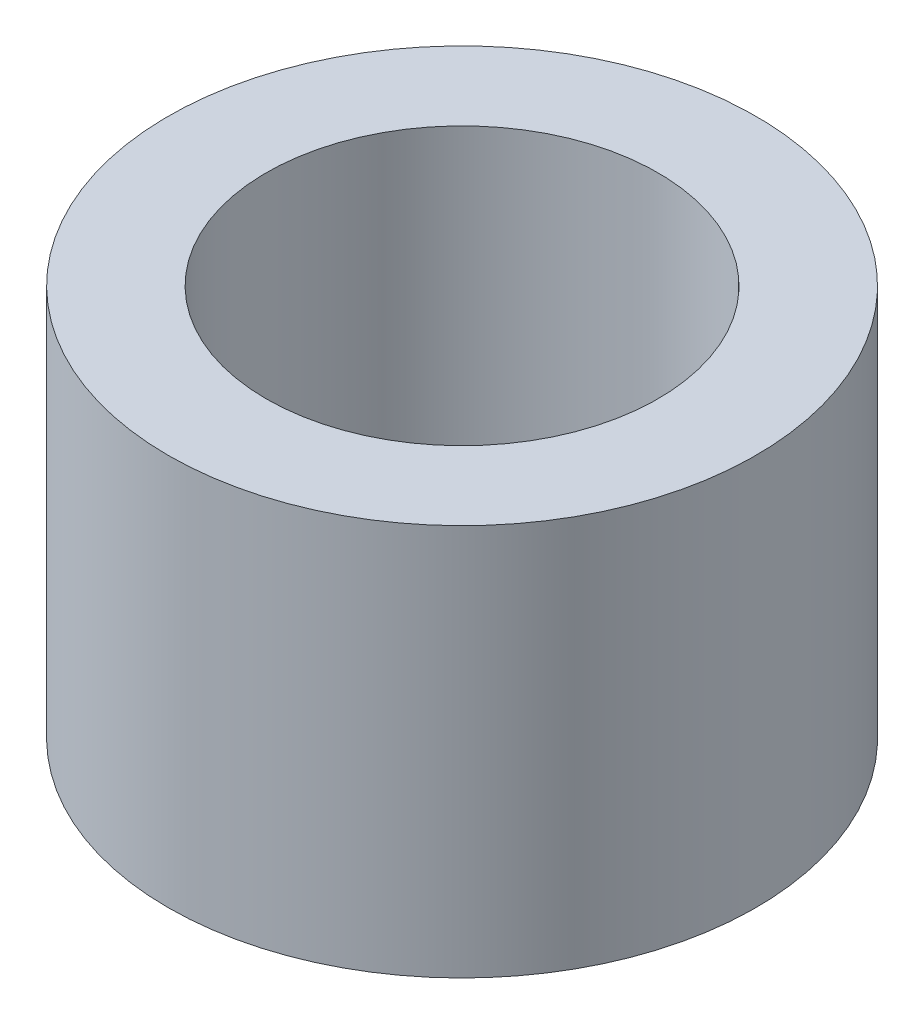
from build123d import *

# Parameters (mm, degrees)
SKETCH1_R           = 4.7625
SKETCH1_R_2         = 3.175
BOSS_EXTRUDE1_DEPTH = 6.35


with BuildPart() as part:
    # Sketch1 → Boss-Extrude1 (new body)
    with BuildSketch(Plane(origin=(0, 0, 0), x_dir=(1, 0, 0), z_dir=(0, 1, 0))):
        with Locations(Location((0, 0, 0), (0, 0, 270))):
            Circle(SKETCH1_R)
        with Locations(Location((0, 0, 0), (0, 0, 270))):
            Circle(SKETCH1_R_2, mode=Mode.SUBTRACT)
    extrude(amount=BOSS_EXTRUDE1_DEPTH)


solid = part.part
